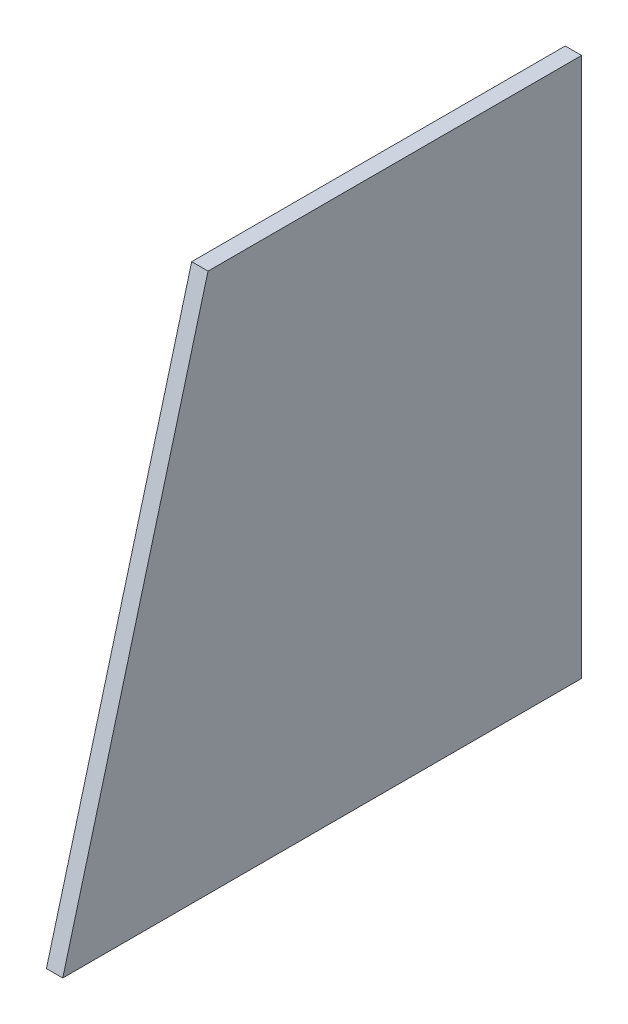
from build123d import *

# Parameters (mm, degrees)
BOSS_EXTRUDE1_DEPTH = 5


with BuildPart() as part:
    # Sketch1 → Boss-Extrude1 (new body)
    with BuildSketch(Plane(origin=(0, 0, 0), x_dir=(0, 0, -1), z_dir=(1, 0, 0))):
        Polygon((0, 0), (44.45, 165.1), (158.75, 165.1), (158.75, 0), align=None)
    extrude(amount=BOSS_EXTRUDE1_DEPTH)


solid = part.part
